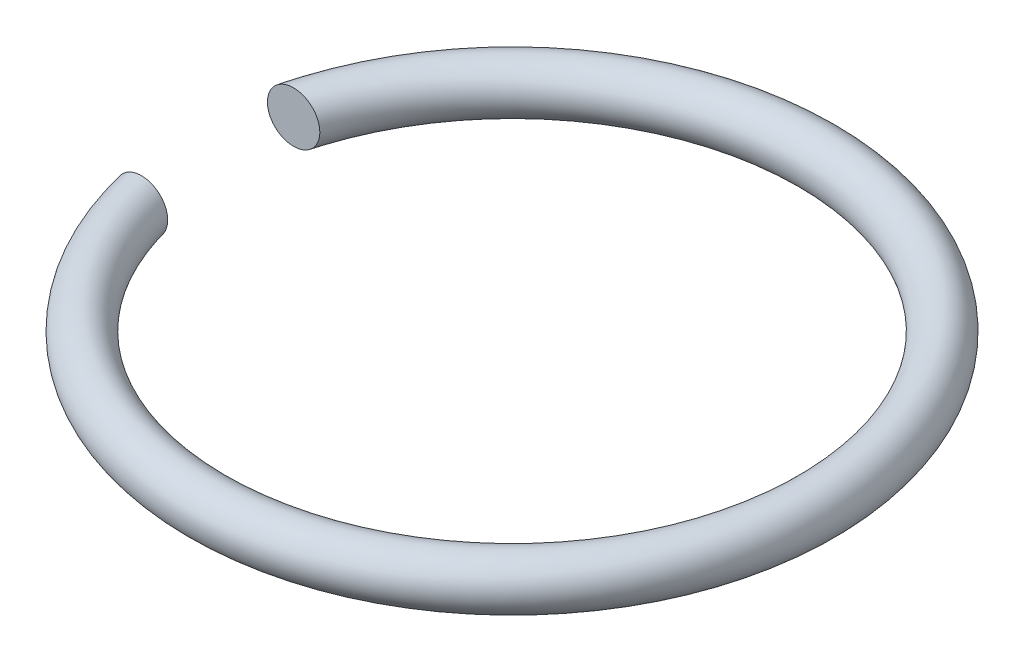
from build123d import *

# Parameters (mm, degrees)
SKETCH_1_R               = 1
CUT_EXTRUDE_1_DEPTH      = 19.49324216
CUT_EXTRUDE_1_DEPTH_BACK = 19.49324216
SKETCH_2_W               = 18.251865013
SKETCH_2_H               = 6


with BuildPart() as part:
    # Эскиз1 → Повернуть1 (revolve)
    with BuildSketch(Plane.XY, mode=Mode.PRIVATE) as revolve_1_sk:
        with Locations((-12, 1)):
            Circle(SKETCH_1_R)
    revolve(revolve_1_sk.sketch.rotate(Axis((0, 0, 0), (0, 1, 0)), 270), axis=Axis((0, 0, 0), (0, 1, 0)))

    # Эскиз2 → Вырез-Вытянуть1 (cut, two sides: drawn at the far end of the back side and taken through both)
    with BuildSketch(Plane(origin=(0, 0, 0), x_dir=(1, 0, 0), z_dir=(0, 1, 0)).offset(-CUT_EXTRUDE_1_DEPTH_BACK)):
        with Locations((-9.484061507, 0)):
            Rectangle(SKETCH_2_W, SKETCH_2_H)
    extrude(amount=CUT_EXTRUDE_1_DEPTH + CUT_EXTRUDE_1_DEPTH_BACK, mode=Mode.SUBTRACT)


solid = part.part
